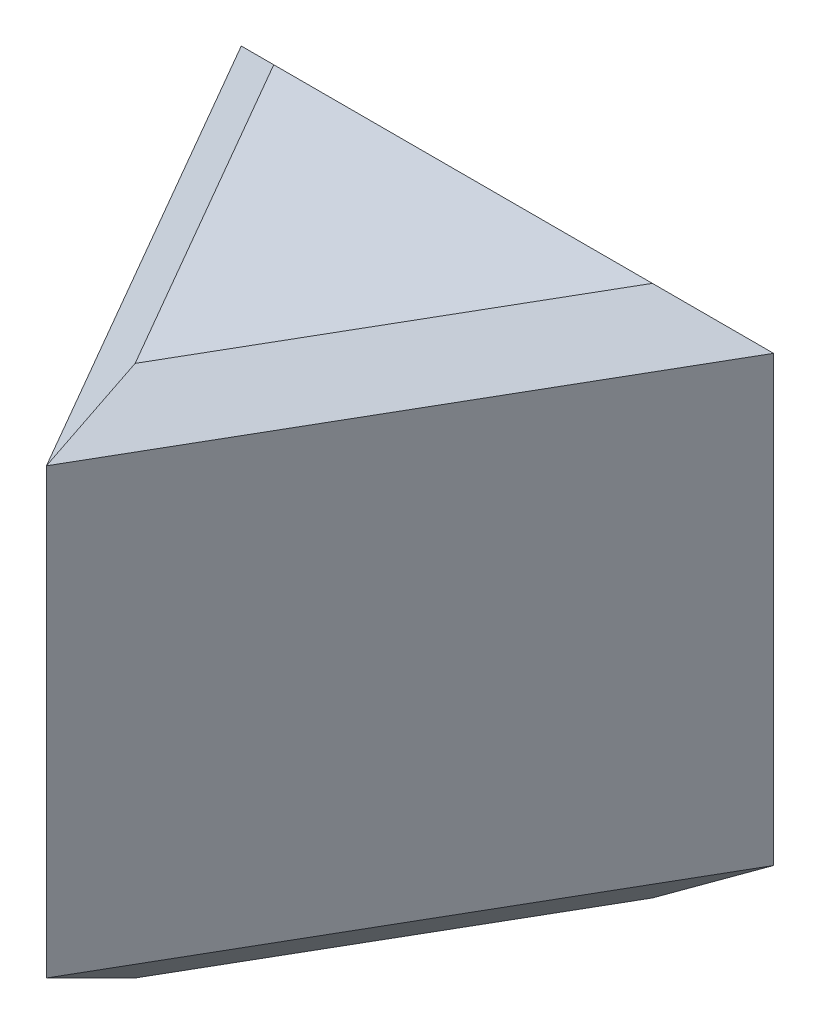
from build123d import *

# Parameters (mm, degrees)
BOSS_EXTRUDE1_DEPTH = 3
CHAMFER2_SIZE       = 0.5


with BuildPart() as part:
    # Sketch1 → Boss-Extrude1 (new, symmetric)
    with BuildSketch(Plane(origin=(0, 0, 0), x_dir=(1, 0, 0), z_dir=(0, 1, 0))):
        Polygon((0, -3.464101615), (3, 1.732050808), (-3, 1.732050808), align=None)
    extrude(amount=BOSS_EXTRUDE1_DEPTH, both=True)

    # Chamfer2
    chamfer2_edges = [part.edges().sort_by_distance(p)[0] for p in [
        (0, 3, -1.732050808),
        (0, -3, -1.732050808),
        (1.5, -3, 0.866025404),
        (-1.5, -3, 0.866025404),
        (-1.5, 3, 0.866025404),
        (1.5, 3, 0.866025404),
    ]]
    chamfer(chamfer2_edges, length=CHAMFER2_SIZE)


solid = part.part
